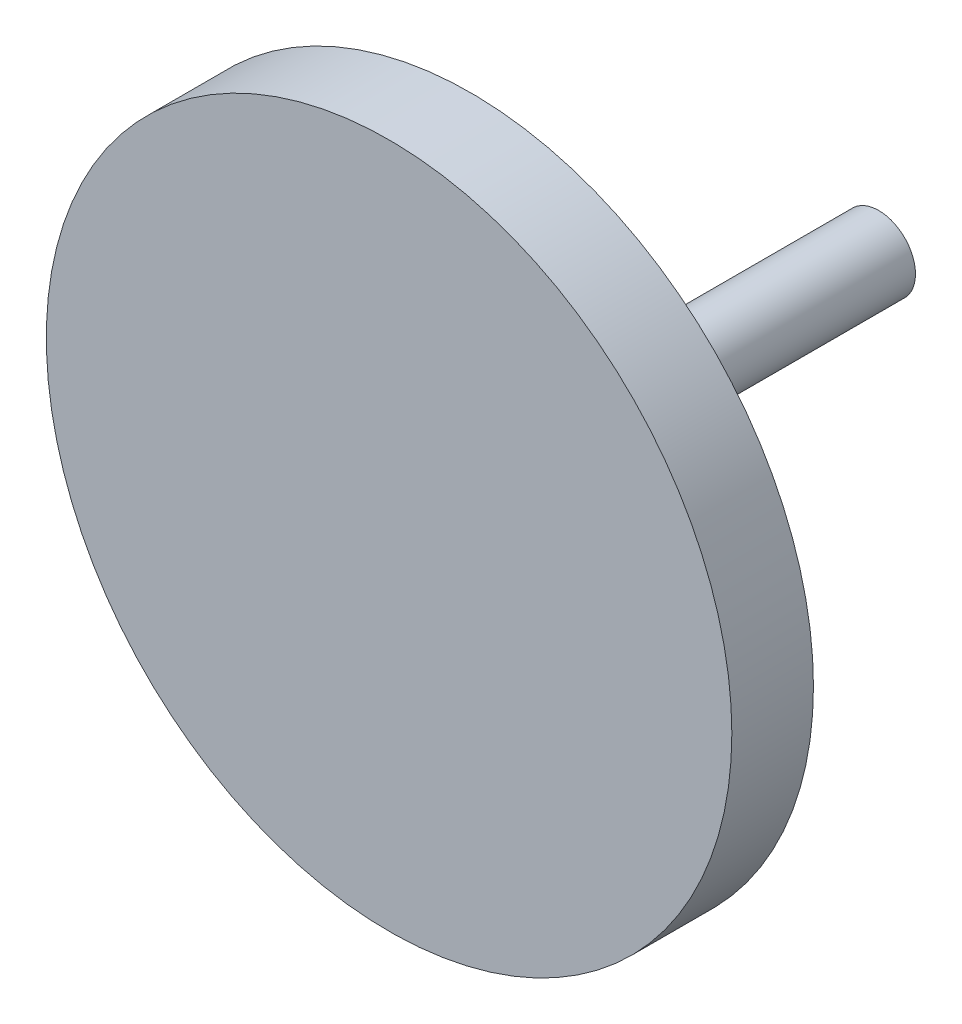
from build123d import *

# Parameters (mm, degrees)
SKETCH3_R           = 2.25
BOSS_EXTRUDE1_DEPTH = 15
SKETCH4_R           = 21
BOSS_EXTRUDE2_DEPTH = 5


with BuildPart() as part:
    # Sketch3 → Boss-Extrude1 (new, symmetric)
    with BuildSketch(Plane.XY):
        Circle(SKETCH3_R)
    extrude(amount=BOSS_EXTRUDE1_DEPTH, both=True)

    # Sketch4 → Boss-Extrude2 (add)
    with BuildSketch(Plane.XY.offset(15)):
        Circle(SKETCH4_R)
    extrude(amount=-BOSS_EXTRUDE2_DEPTH)


solid = part.part
